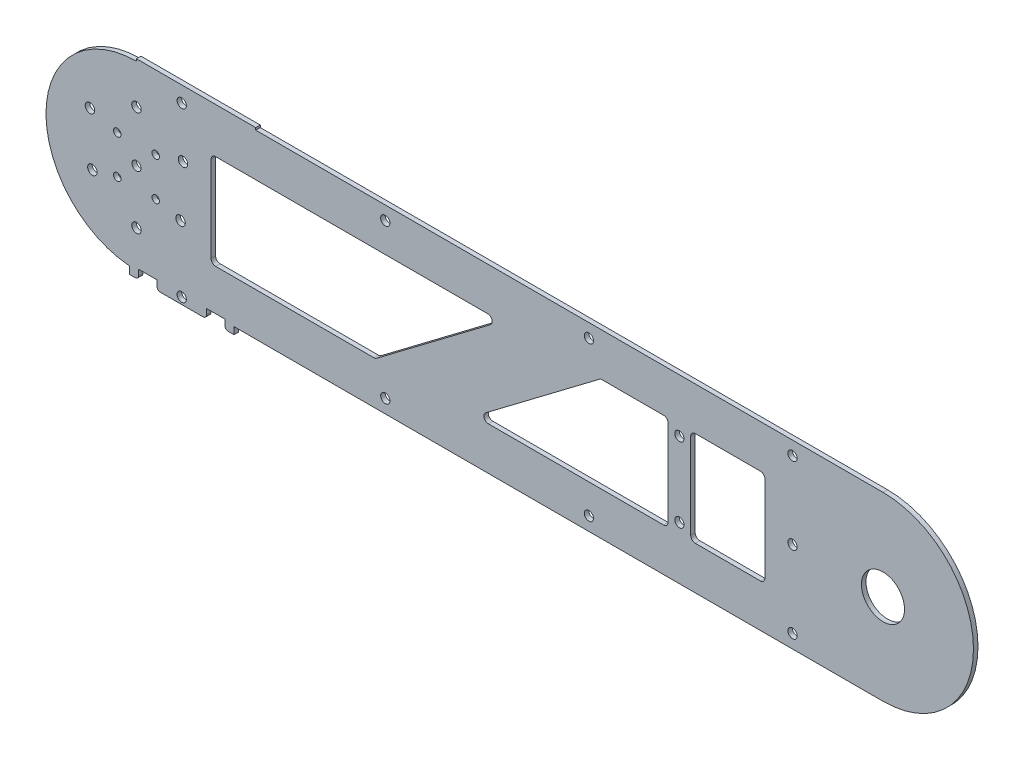
from build123d import *

# Parameters (mm, degrees)
SKETCH_1_R          = 2.1
SKETCH_1_R_2        = 1.65
SKETCH_1_R_3        = 2
SKETCH_1_R_4        = 2.05
SKETCH_1_R_5        = 9.52
EXTRUDE_1_DEPTH     = 2
SKETCH_3_W          = 52.726125437
SKETCH_3_H          = 0.98
SKETCH_3_W_2        = 46.2
SKETCH_3_H_2        = 3.817212264
EXTRUDE_2_DEPTH     = 2
SKETCH_2_R          = 2.05
SKETCH_2_W          = 32.809844138
SKETCH_2_H          = 42
CUT_EXTRUDE_1_DEPTH = 4
FILLET_1_R          = 2
FILLET_2_R          = 1.5


with BuildPart() as part:
    # 草图1 → 凸台-拉伸1 (new body)
    with BuildSketch(Plane.XY):
        with BuildLine():
            ThreePointArc((-1.457142857, 39.854285714), (-41.457142857, -0.145714286), (-1.457142857, -40.145714286))
            Line((-1.457142857, -40.145714286), (328.542857143, -40.145714286))
            ThreePointArc((328.542857143, -40.145714286), (368.542857143, -0.145714286), (328.542857143, 39.854285714))
            Line((328.542857143, 39.854285714), (-1.457142857, 39.854285714))
        make_face()
        with Locations((-1.457142857, -23.895714286)):
            Circle(SKETCH_1_R, mode=Mode.SUBTRACT)
        with Locations((-20.942714442, -11.395714286)):
            Circle(SKETCH_1_R, mode=Mode.SUBTRACT)
        with Locations((18.028428728, -11.395714286)):
            Circle(SKETCH_1_R, mode=Mode.SUBTRACT)
        with Locations((-9.957142857, -8.645714286)):
            Circle(SKETCH_1_R_2, mode=Mode.SUBTRACT)
        with Locations((7.042857143, -8.645714286)):
            Circle(SKETCH_1_R_2, mode=Mode.SUBTRACT)
        with Locations((-1.457142857, -0.145714286)):
            Circle(SKETCH_1_R_3, mode=Mode.SUBTRACT)
        with Locations((238.542857143, -16.645714286)):
            Circle(SKETCH_1_R_4, mode=Mode.SUBTRACT)
        with Locations((288.542857143, -0.145714286)):
            Circle(SKETCH_1_R_4, mode=Mode.SUBTRACT)
        with Locations((328.542857143, -0.145714286)):
            Circle(SKETCH_1_R_5, mode=Mode.SUBTRACT)
        with Locations((-9.957142857, 8.354285714)):
            Circle(SKETCH_1_R_2, mode=Mode.SUBTRACT)
        with Locations((7.042857143, 8.354285714)):
            Circle(SKETCH_1_R_2, mode=Mode.SUBTRACT)
        with Locations((-22.025246197, 11.729285714)):
            Circle(SKETCH_1_R, mode=Mode.SUBTRACT)
        with Locations((19.110960483, 11.729285714)):
            Circle(SKETCH_1_R, mode=Mode.SUBTRACT)
        with Locations((-1.457142857, 22.354285714)):
            Circle(SKETCH_1_R, mode=Mode.SUBTRACT)
        with Locations((238.542857143, 16.354285714)):
            Circle(SKETCH_1_R_4, mode=Mode.SUBTRACT)
    extrude(amount=EXTRUDE_1_DEPTH)

    # 草图3 → 凸台-拉伸2 (add)
    with BuildSketch(Plane.XY.offset(2)):
        with Locations((24.905919862, 40.344285714)):
            Rectangle(SKETCH_3_W, SKETCH_3_H)
        with Locations((18.542857143, -41.36131722)):
            Rectangle(SKETCH_3_W_2, SKETCH_3_H_2)
    extrude(amount=-EXTRUDE_2_DEPTH)

    # 草图2 → 切除-拉伸1 (cut)
    with BuildSketch(Plane.XY.offset(2)):
        with Locations((18.542857143, 33.854285714)):
            Circle(SKETCH_2_R)
        with Locations((108.542857143, 33.854285714)):
            Circle(SKETCH_2_R)
        with Locations((198.542857143, 33.854285714)):
            Circle(SKETCH_2_R)
        with Locations((288.542857143, 33.854285714)):
            Circle(SKETCH_2_R)
        with Locations((108.542857143, -34.145714286)):
            Circle(SKETCH_2_R)
        with Locations((198.542857143, -34.145714286)):
            Circle(SKETCH_2_R)
        with Locations((288.542857143, -34.145714286)):
            Circle(SKETCH_2_R)
        with Locations((18.542857143, -40.329923352)):
            Circle(SKETCH_2_R)
        Polygon((31.542857143, -21.145714286), (104.183898028, -21.145714286), (159.772133322, 20.854285714), (31.542857143, 20.854285714), align=None)
        Polygon((148.123425102, -21.145714286), (203.711660396, 20.854285714), (233.542857143, 20.854285714), (233.542857143, -21.145714286), align=None)
        with Locations((259.947779212, -0.145714286)):
            Rectangle(SKETCH_2_W, SKETCH_2_H)
        Polygon((29.492857143, -39.279923352), (37.592857143, -39.279923352), (37.592857143, -41.379923352), (37.592857143, -45.95931596), (29.492857143, -45.95931596), (29.492857143, -41.379923352), align=None)
        Polygon((-0.507142857, -39.279923352), (7.592857143, -39.279923352), (7.592857143, -41.379923352), (7.592857143, -45.95931596), (-0.507142857, -45.95931596), (-0.507142857, -41.379923352), align=None)
    extrude(amount=-CUT_EXTRUDE_1_DEPTH, mode=Mode.SUBTRACT)

    # 圆角1
    fillet_1_edges = [part.edges().sort_by_distance(p)[0] for p in [
        (243.542857143, 20.854285714, 1),
        (276.352701281, 20.854285714, 1),
        (276.352701281, -21.145714286, 1),
        (243.542857143, -21.145714286, 1),
        (31.542857143, -21.145714286, 1),
        (31.542857143, 20.854285714, 1),
        (159.772133322, 20.854285714, 1),
        (104.183898028, -21.145714286, 1),
        (203.711660396, 20.854285714, 1),
        (233.542857143, 20.854285714, 1),
        (233.542857143, -21.145714286, 1),
        (148.123425102, -21.145714286, 1),
    ]]
    fillet(fillet_1_edges, radius=FILLET_1_R)

    # 圆角2
    fillet_2_edges = [part.edges().sort_by_distance(p)[0] for p in [
        (37.592857143, -43.269923352, 1),
        (29.492857143, -43.269923352, 1),
        (7.592857143, -43.269923352, 1),
        (-0.507142857, -43.269923352, 1),
    ]]
    fillet(fillet_2_edges, radius=FILLET_2_R)


solid = part.part
